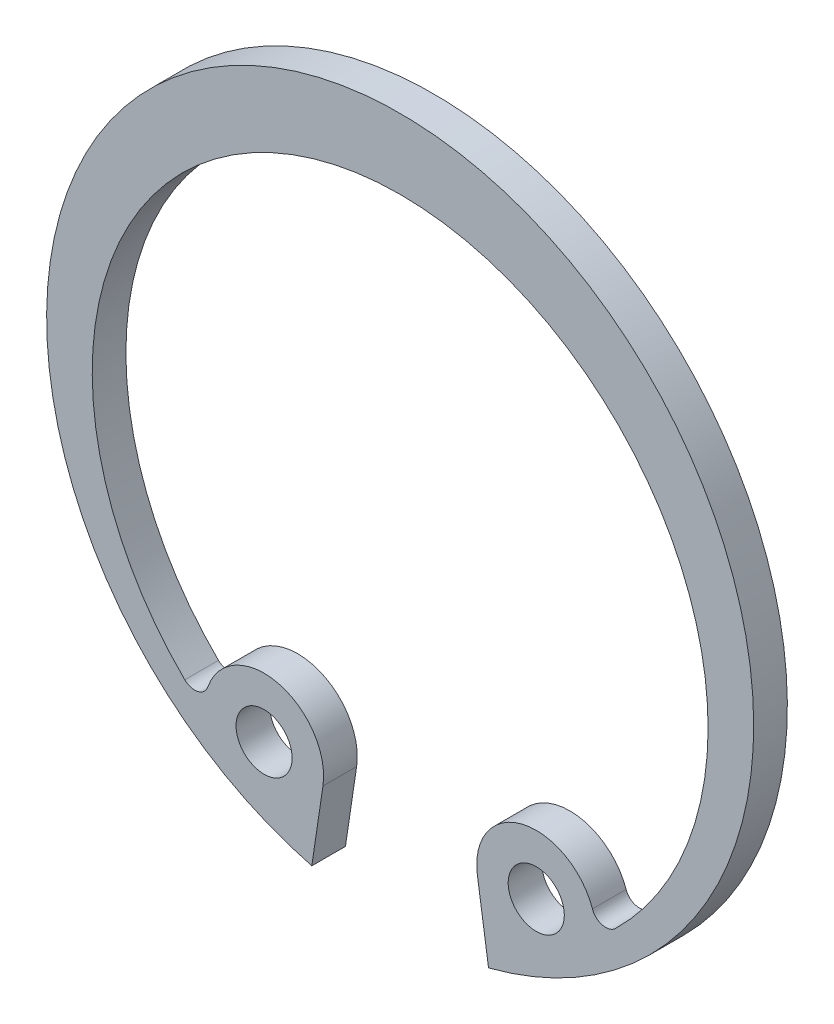
from build123d import *

# Parameters (mm, degrees)
SKETCH1_R           = 1
BOSS_EXTRUDE1_DEPTH = 1.2


with BuildPart() as part:
    # Sketch1 → Boss-Extrude1 (new body)
    with BuildSketch(Plane.XY):
        with BuildLine():
            Line((-2.752083615, -9.537376839), (-3.15, -12.199897541))
            ThreePointArc((-3.15, -12.199897541), (0, 12.6), (3.15, -12.199897541))
            Line((3.15, -12.199897541), (2.752083615, -9.537376839))
            ThreePointArc((2.752083615, -9.537376839), (4.342461756, -7.164238569), (6.853389071, -8.526711284))
            ThreePointArc((6.853389071, -8.526711284), (7.211274213, -8.849138625), (7.675286995, -8.719781357))
            ThreePointArc((7.675286995, -8.719781357), (0, 10.1), (-7.675286995, -8.719781357))
            ThreePointArc((-7.675286995, -8.719781357), (-7.211274213, -8.849138625), (-6.853389071, -8.526711284))
            ThreePointArc((-6.853389071, -8.526711284), (-4.342461756, -7.164238569), (-2.752083615, -9.537376839))
        make_face()
        with Locations((-4.85, -9.223841134)):
            Circle(SKETCH1_R, mode=Mode.SUBTRACT)
        with Locations((4.85, -9.223841134)):
            Circle(SKETCH1_R, mode=Mode.SUBTRACT)
    extrude(amount=BOSS_EXTRUDE1_DEPTH)


solid = part.part
